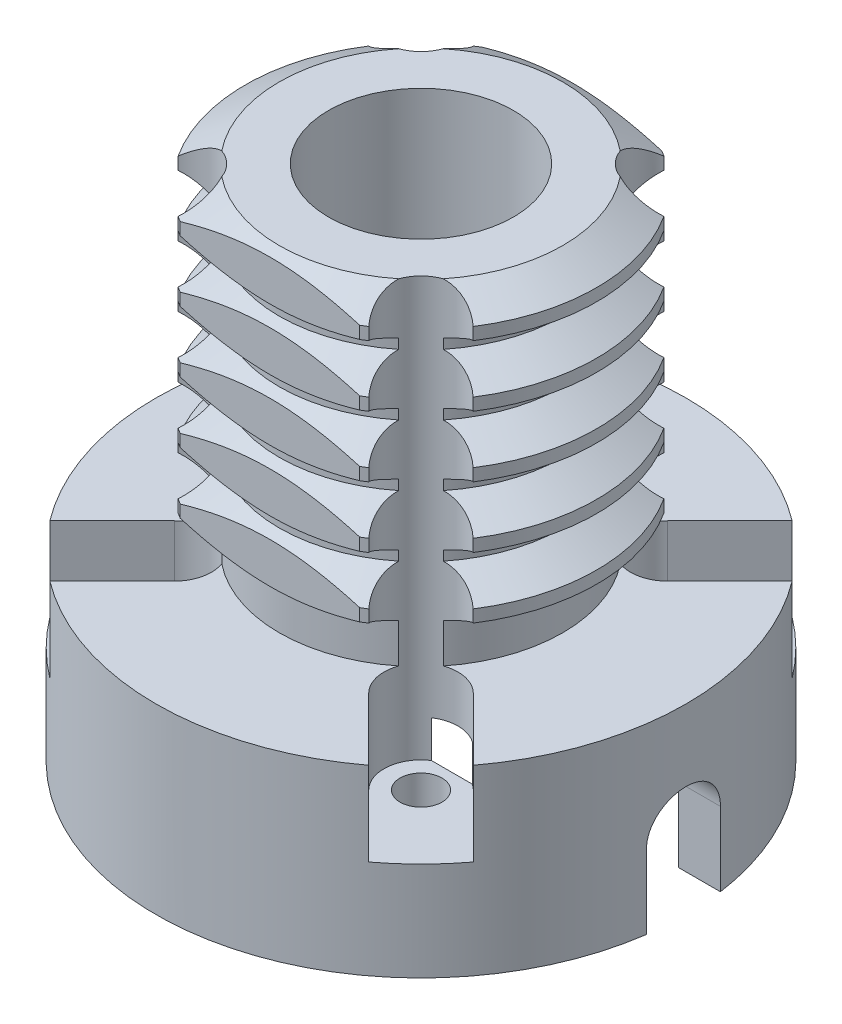
from build123d import *

# Parameters (mm, degrees)
SKETCH_1_R               = 21.5
EXTRUDE_1_DEPTH          = 14.8
SKETCH_2_R               = 18.125
CUT_EXTRUDE_1_DEPTH      = 3
SKETCH_3_R               = 11.5
EXTRUDE_2_DEPTH          = 3.2
SKETCH_4_R               = 14.25
EXTRUDE_3_DEPTH          = 24
SKETCH_5_R               = 7.5
CUT_EXTRUDE_2_DEPTH      = 52.850747343
CUT_EXTRUDE_3_DEPTH      = 8
CUT_EXTRUDE_4_DEPTH      = 8
SKETCH_9_R               = 3
CUT_EXTRUDE_5_DEPTH      = 34
CUT_EXTRUDE_6_DEPTH      = 6.8
PATTERN_CIRCULAR_1_COUNT = 4
SKETCH_11_R              = 1.7
CUT_EXTRUDE_7_DEPTH      = 8
PATTERN_CIRCULAR_2_COUNT = 4
CUT_EXTRUDE_START        = -2.1
SKETCH_12_R              = 3
CUT_EXTRUDE_8_DEPTH      = 2.1
PATTERN_CIRCULAR_3_COUNT = 4
SKETCH_13_W              = 30
SKETCH_13_H              = 9
CUT_EXTRUDE_9_DEPTH      = 41.796323536


with BuildPart() as part:
    # 草图1 → 凸台-拉伸1 (new body)
    with BuildSketch(Plane(origin=(0, 0, 0), x_dir=(1, 0, 0), z_dir=(0, 1, 0))):
        with Locations(Location((0, 0, 0), (0, 0, 270))):
            Circle(SKETCH_1_R)
    extrude(amount=EXTRUDE_1_DEPTH)

    # 草图2 → 切除-拉伸1 (cut)
    with BuildSketch(Plane.XZ):
        with Locations(Location((0, 0, 0), (0, 0, 270))):
            Circle(SKETCH_2_R)
    extrude(amount=-CUT_EXTRUDE_1_DEPTH, mode=Mode.SUBTRACT)

    # 草图3 → 凸台-拉伸2 (add)
    with BuildSketch(Plane(origin=(0, 14.8, 0), x_dir=(1, 0, 0), z_dir=(0, 1, 0))):
        with Locations(Location((0, 0, 0), (0, 0, 270))):
            Circle(SKETCH_3_R)
    extrude(amount=EXTRUDE_2_DEPTH)

    # 草图4 → 凸台-拉伸3 (add)
    with BuildSketch(Plane(origin=(0, 18, 0), x_dir=(1, 0, 0), z_dir=(0, 1, 0))):
        with Locations(Location((0, 0, 0), (0, 0, 270))):
            Circle(SKETCH_4_R)
    extrude(amount=EXTRUDE_3_DEPTH)

    # 草图5 → 切除-拉伸2 (cut, through all)
    with BuildSketch(Plane(origin=(0, 42, 0), x_dir=(1, 0, 0), z_dir=(0, 1, 0))):
        with Locations(Location((0, 0, 0), (0, 0, 270))):
            Circle(SKETCH_5_R)
    extrude(amount=-CUT_EXTRUDE_2_DEPTH, mode=Mode.SUBTRACT)

    # 草图6 → 切除-拉伸3 (cut)
    with BuildSketch(Plane.XZ.offset(-3)):
        with BuildLine():
            Line((0, 7.5), (-5.5, 7.5))
            ThreePointArc((-5.5, 7.5), (-6.914213562, 6.914213562), (-7.5, 5.5))
            Line((-7.5, 5.5), (-7.5, -5.5))
            ThreePointArc((-7.5, -5.5), (-6.914213562, -6.914213562), (-5.5, -7.5))
            Line((-5.5, -7.5), (16.500473478, -7.5))
            ThreePointArc((16.500473478, -7.5), (18.125, 0), (16.500473478, 7.5))
            Line((16.500473478, 7.5), (0, 7.5))
        make_face()
    extrude(amount=-CUT_EXTRUDE_3_DEPTH, mode=Mode.SUBTRACT)

    # 草图7 → 切除-拉伸4 (cut)
    with BuildSketch(Plane(origin=(21.5, 0, 0), x_dir=(0, 0, -1), z_dir=(1, 0, 0))):
        with BuildLine():
            ThreePointArc((3, 6), (0, 9), (-3, 6))
            Line((-3, 6), (3, 6))
        make_face()
        with BuildLine():
            Line((3, 6), (-3, 6))
            ThreePointArc((-3, 6), (0, 3), (3, 6))
        make_face()
        with BuildLine():
            Line((-3, 6), (-3, -6))
            Line((-3, -6), (3, -6))
            Line((3, -6), (3, 6))
            ThreePointArc((3, 6), (0, 3), (-3, 6))
        make_face()
    extrude(amount=-CUT_EXTRUDE_4_DEPTH, mode=Mode.SUBTRACT)

    # 草图8 → 切除-旋转1 (revolve, cut)
    with BuildSketch(Plane.XY):
        Polygon((-16.5, 42), (-16.5, 18), (-11.5, 18), (-14.25, 19.58), (-14.25, 20.58), (-11.5, 22.16), (-11.5, 22.96), (-14.25, 24.54), (-14.25, 25.54), (-11.5, 27.12), (-11.5, 27.92), (-14.25, 29.5), (-14.25, 30.5), (-11.5, 32.08), (-11.5, 32.88), (-14.25, 34.46), (-14.25, 35.46), (-11.5, 37.04), (-11.5, 37.84), (-14.25, 39.42), (-14.25, 40.42), (-11.5, 42), align=None)
    revolve(axis=Axis((0, 42, 0), (0, -1, 0)), mode=Mode.SUBTRACT)

    # 草图9 → 切除-拉伸5 (cut)
    with BuildSketch(Plane(origin=(0, 42, 0), x_dir=(1, 0, 0), z_dir=(0, 1, 0))):
        with Locations(Location((10, 10, 0), (0, 0, 250.242977112))):
            Circle(SKETCH_9_R)
        with Locations(Location((-10, 10, 0), (0, 0, 270))):
            Circle(SKETCH_9_R)
        with Locations(Location((10, -10, 0), (0, 0, 220.987500032))):
            Circle(SKETCH_9_R)
        with Locations(Location((-10, -10, 0), (0, 0, 270))):
            Circle(SKETCH_9_R)
    extrude(amount=-CUT_EXTRUDE_5_DEPTH, mode=Mode.SUBTRACT)

    # 草图10 → 切除-拉伸6 (cut)
    with BuildSketch(Plane(origin=(0, 14.8, 0), x_dir=(1, 0, 0), z_dir=(0, 1, 0))):
        with BuildLine():
            Line((-17.175389561, 12.932748874), (-12.121320344, 7.878679656))
            ThreePointArc((-12.121320344, 7.878679656), (-12.121320344, 12.121320344), (-7.878679656, 12.121320344))
            Line((-7.878679656, 12.121320344), (-12.932748874, 17.175389561))
            ThreePointArc((-12.932748874, 17.175389561), (-15.202795796, 15.202795796), (-17.175389561, 12.932748874))
        make_face()
    cut_extrude_6 = extrude(amount=-CUT_EXTRUDE_6_DEPTH, mode=Mode.SUBTRACT)

    # 阵列(圆周)1: 切除-拉伸6 ×4 about axis
    pattern_circular_1_axis = Axis((0, 0, 0), (0, 1, 0))
    for i in range(1, PATTERN_CIRCULAR_1_COUNT):
        add(cut_extrude_6.rotate(pattern_circular_1_axis, i * 360 / PATTERN_CIRCULAR_1_COUNT), mode=Mode.SUBTRACT)

    # 草图11 → 切除-拉伸7 (cut)
    with BuildSketch(Plane(origin=(0, 8, 0), x_dir=(1, 0, 0), z_dir=(0, 1, 0))):
        with Locations(Location((-10, 10, 0), (0, 0, 270))):
            Circle(SKETCH_11_R)
    cut_extrude_7 = extrude(amount=-CUT_EXTRUDE_7_DEPTH, mode=Mode.SUBTRACT)

    # 阵列(圆周)2: 切除-拉伸7 ×4 about axis
    pattern_circular_2_axis = Axis((0, 0, 0), (0, 1, 0))
    for i in range(1, PATTERN_CIRCULAR_2_COUNT):
        add(cut_extrude_7.rotate(pattern_circular_2_axis, i * 360 / PATTERN_CIRCULAR_2_COUNT), mode=Mode.SUBTRACT)

    # 草图12 → 切除-拉伸8 (cut)
    with BuildSketch(Plane.XZ.offset(-3).offset(CUT_EXTRUDE_START)):
        with Locations((10, 10)):
            Circle(SKETCH_12_R)
    cut_extrude_8 = extrude(amount=CUT_EXTRUDE_8_DEPTH, mode=Mode.SUBTRACT)

    # 阵列(圆周)3: 切除-拉伸8 ×4 about axis
    pattern_circular_3_axis = Axis((0, 0, 0), (0, 1, 0))
    for i in range(1, PATTERN_CIRCULAR_3_COUNT):
        add(cut_extrude_8.rotate(pattern_circular_3_axis, i * 360 / PATTERN_CIRCULAR_3_COUNT), mode=Mode.SUBTRACT)

    # 草图13 → 切除-拉伸9 (cut, through all)
    with BuildSketch(Plane(origin=(0, 14.8, 0), x_dir=(1, 0, 0), z_dir=(0, 1, 0))):
        with Locations((0, -16.75)):
            Rectangle(SKETCH_13_W, SKETCH_13_H)
        with BuildLine():
            Line((-12.932748874, 17.175389561), (-8.007359313, 12.25))
            Line((-8.007359313, 12.25), (8.007359313, 12.25))
            Line((8.007359313, 12.25), (12.932748874, 17.175389561))
            ThreePointArc((12.932748874, 17.175389561), (8.353214378, 19.810951758), (3.269174208, 21.25))
            Line((3.269174208, 21.25), (-3.269174208, 21.25))
            ThreePointArc((-3.269174208, 21.25), (-8.353214378, 19.810951758), (-12.932748874, 17.175389561))
        make_face()
    extrude(amount=CUT_EXTRUDE_9_DEPTH, mode=Mode.SUBTRACT)


solid = part.part
